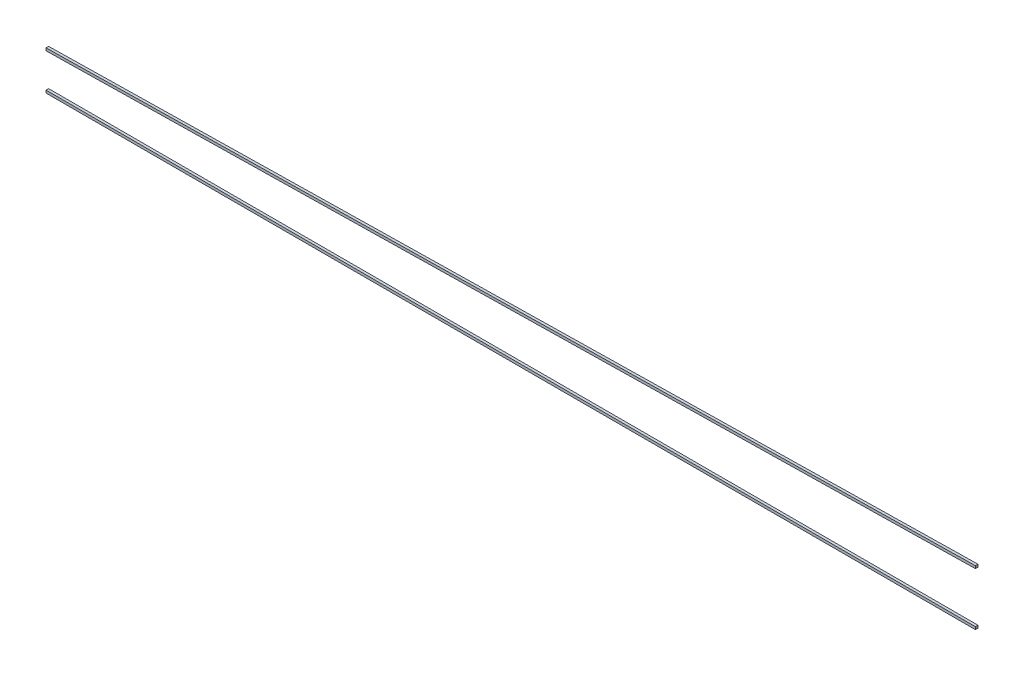
from build123d import *

# Parameters (mm, degrees)
MODEL_W           = 718.7316
MODEL_H           = 2
EXTRUDE_1_DEPTH   = 2
EXTRUDE_1_2_DEPTH = 2


with BuildPart() as part:
    # Model → 凸台-拉伸1 (new body)
    with BuildSketch(Plane.XY):
        with Locations((631.225241677, 76.161607892)):
            Rectangle(MODEL_W, MODEL_H)
    extrude(amount=EXTRUDE_1_DEPTH)


with BuildPart() as body_2:
    # Model → Extrude 1 2 (new body)
    with BuildSketch(Plane.XY):
        Polygon((271.859441677, 103.463901148), (990.591041677, 116.009407892), (990.591041677, 118.009407892), (271.859441677, 105.463901148), align=None)
    extrude(amount=EXTRUDE_1_2_DEPTH)


solid = Compound([part.part, body_2.part])
